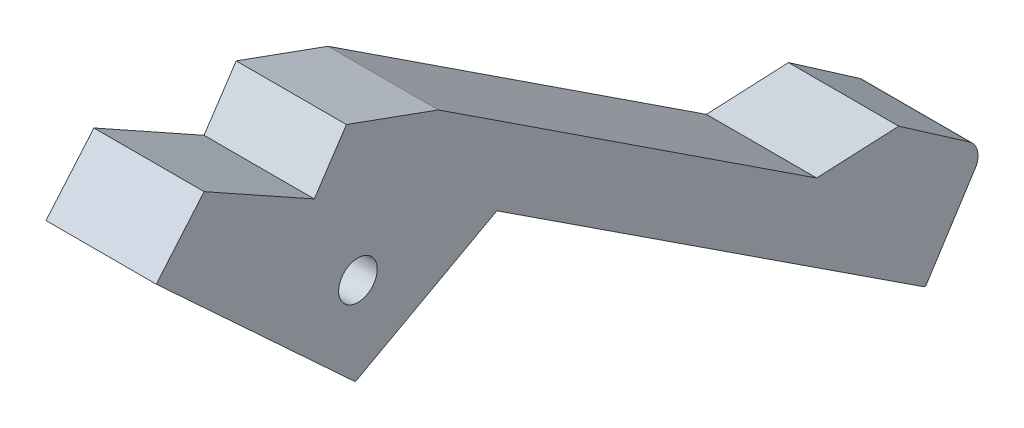
from build123d import *

# Parameters (mm, degrees)
SKETCH_1_R      = 2.1
EXTRUDE_1_DEPTH = 6


with BuildPart() as part:
    # 스케치1 → 보스-돌출1 (new, symmetric)
    with BuildSketch(Plane(origin=(0, 0, 0), x_dir=(0, 0, -1), z_dir=(1, 0, 0))):
        with BuildLine():
            Line((-1.247311697, 15.290072814), (-4.747158569, 10.027630369))
            Line((-4.747158569, 10.027630369), (-16.737908316, 16.712025722))
            Line((-16.737908316, 16.712025722), (-21.94836762, 10.590510846))
            Line((-21.94836762, 10.590510846), (-0.281769869, -9.435112952))
            Line((-0.281769869, -9.435112952), (15.1257089, -1.028923277))
            Line((15.1257089, -1.028923277), (61.632849993, -31.445174091))
            Line((61.632849993, -31.445174091), (61.80599614, -31.445174091))
            Line((61.80599614, -31.445174091), (67.317930071, -22.846306867))
            ThreePointArc((67.317930071, -22.846306867), (67.40457501, -21.419938181), (66.570574662, -20.259559625))
            Line((66.570574662, -20.259559625), (58.8607522, -14.920439997))
            Line((58.8607522, -14.920439997), (49.925171415, -15.334910855))
            Line((49.925171415, -15.334910855), (8.746820412, 11.671154757))
            Line((8.746820412, 11.671154757), (-1.247311697, 15.290072814))
        make_face()
        Circle(SKETCH_1_R, mode=Mode.SUBTRACT)
    extrude(amount=EXTRUDE_1_DEPTH, both=True)


solid = part.part
